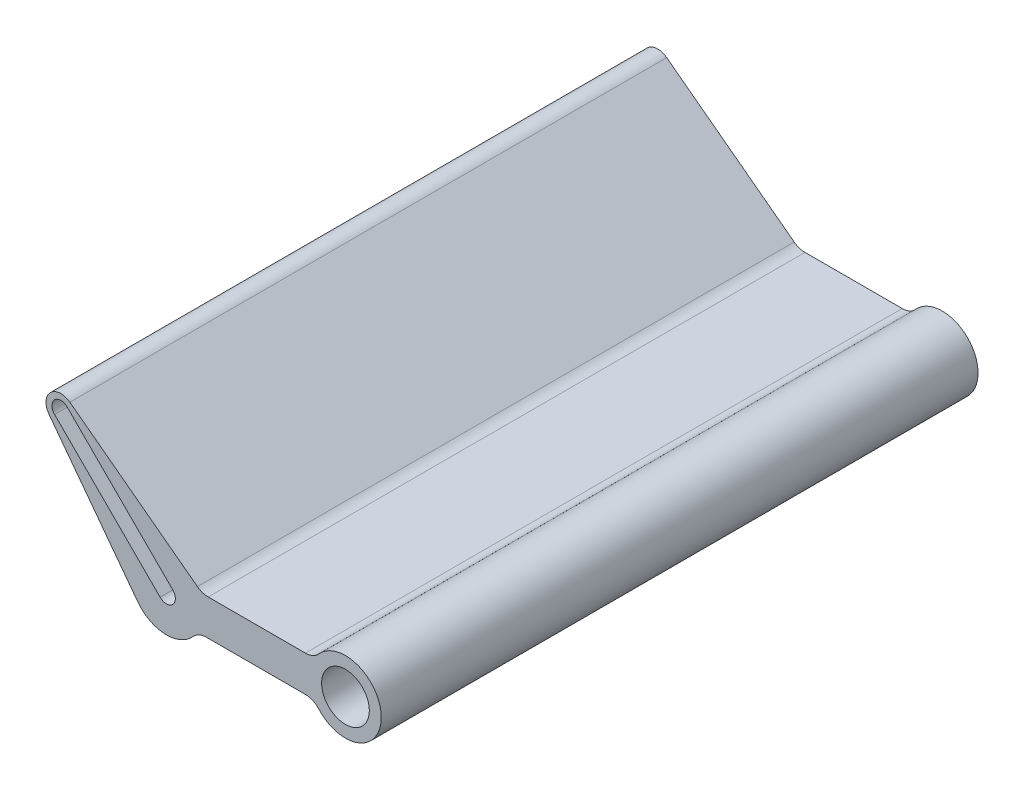
from build123d import *

# Parameters (mm, degrees)
SKETCH13_R          = 40
BOSS_EXTRUDE1_DEPTH = 1000


with BuildPart() as part:
    # Sketch13 → Boss-Extrude1 (new body)
    with BuildSketch(Plane.XY):
        with BuildLine():
            Line((51.91795422, 36.025866242), (-161.747997967, 196.755140095))
            ThreePointArc((-161.747997967, 196.755140095), (-194.454364826, 194.454364826), (-196.755140095, 161.747997967))
            Line((-196.755140095, 161.747997967), (-47.948267516, -36.068873592))
            ThreePointArc((-47.948267516, -36.068873592), (-2.54296529, -59.946086841), (44.72135955, -40))
            ThreePointArc((44.72135955, -40), (54.834590611, -32.613872125), (67.082039325, -30))
            Line((67.082039325, -30), (232.917960675, -30))
            ThreePointArc((232.917960675, -30), (245.165409389, -32.613872125), (255.27864045, -40))
            ThreePointArc((255.27864045, -40), (360, 0), (255.27864045, 40))
            ThreePointArc((255.27864045, 40), (245.165409389, 32.613872125), (232.917960675, 30))
            Line((232.917960675, 30), (69.952391016, 30))
            ThreePointArc((69.952391016, 30), (60.445130968, 31.546318228), (51.91795422, 36.025866242))
        make_face()
        with Locations((300, 0)):
            Circle(SKETCH13_R, mode=Mode.SUBTRACT)
        with BuildLine():
            Line((-10.606601718, -10.606601718), (-187.383297014, 166.170093579))
            ThreePointArc((-187.383297014, 166.170093579), (-187.383297014, 187.383297014), (-166.170093579, 187.383297014))
            Line((-166.170093579, 187.383297014), (10.606601718, 10.606601718))
            ThreePointArc((10.606601718, 10.606601718), (10.606601718, -10.606601718), (-10.606601718, -10.606601718))
        make_face(mode=Mode.SUBTRACT)
    extrude(amount=BOSS_EXTRUDE1_DEPTH)


solid = part.part
